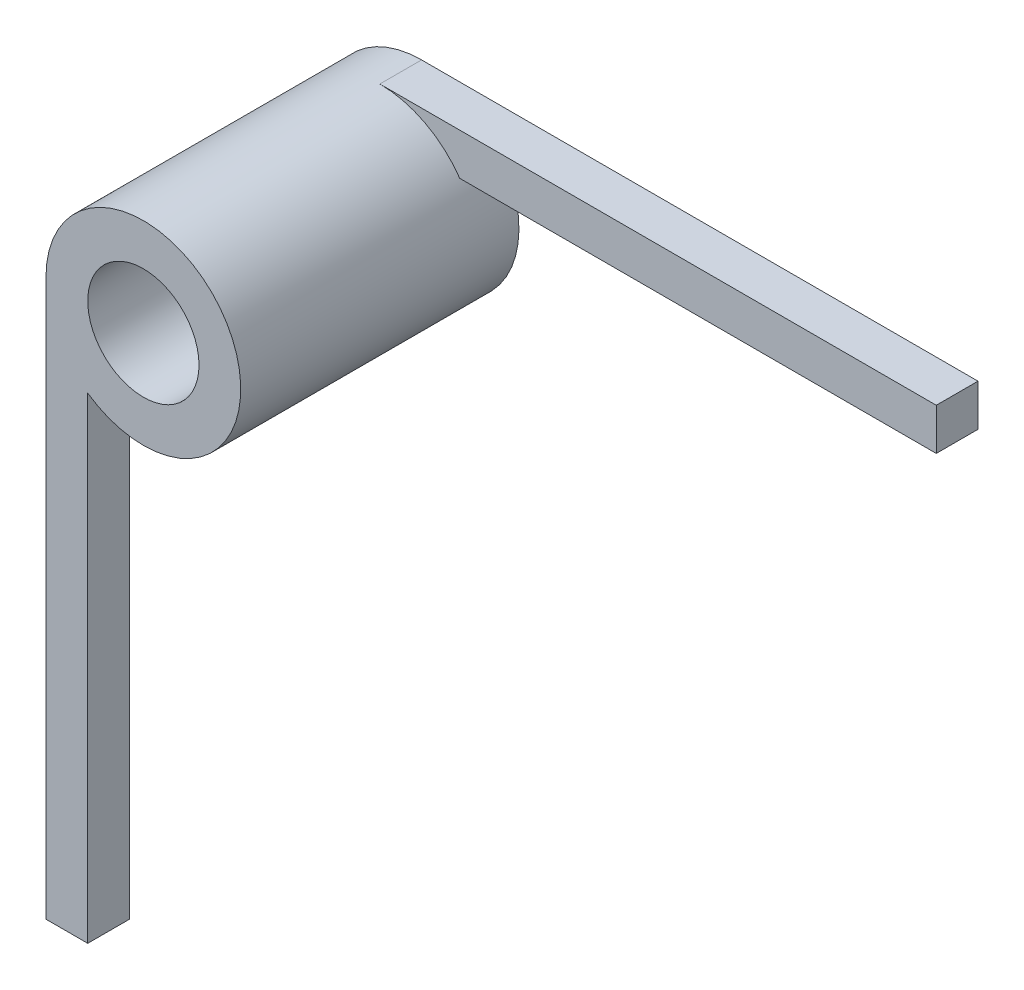
from build123d import *

# Parameters (mm, degrees)
SKETCH_1_R      = 1.75
SKETCH_1_R_2    = 1
EXTRUDE_1_DEPTH = 2.5
SKETCH_3_W      = 0.75
SKETCH_3_H      = 10
EXTRUDE_2_DEPTH = 0.75
SKETCH_4_W      = 10
SKETCH_4_H      = 0.75
EXTRUDE_3_DEPTH = 0.75


with BuildPart() as part:
    # 草图1 → 凸台-拉伸1 (new, symmetric)
    with BuildSketch(Plane.XY):
        Circle(SKETCH_1_R)
        Circle(SKETCH_1_R_2, mode=Mode.SUBTRACT)
    extrude(amount=EXTRUDE_1_DEPTH, both=True)

    # 草图3 → 凸台-拉伸2 (add)
    with BuildSketch(Plane.XY.offset(2.5)):
        with Locations((-1.375, -5)):
            Rectangle(SKETCH_3_W, SKETCH_3_H)
    extrude(amount=-EXTRUDE_2_DEPTH)

    # 草图4 → 凸台-拉伸3 (add)
    with BuildSketch(Plane(origin=(0, 0, -2.5), x_dir=(-1, 0, 0), z_dir=(0, 0, -1))):
        with Locations((-5, 1.375)):
            Rectangle(SKETCH_4_W, SKETCH_4_H)
    extrude(amount=-EXTRUDE_3_DEPTH)


solid = part.part
